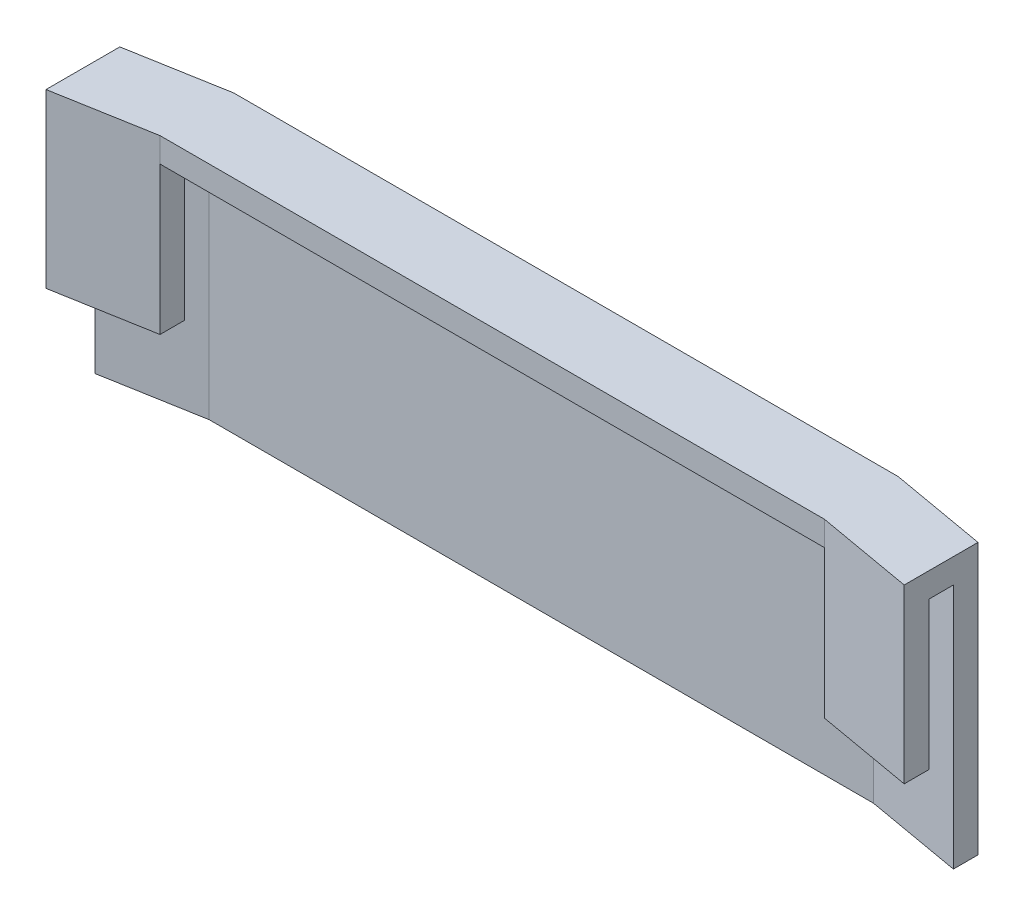
from build123d import *

# Parameters (mm, degrees)
BOSS_EXTRUDE1_DEPTH = 2
BOSS_EXTRUDE5_DEPTH = 22
BOSS_EXTRUDE6_DEPTH = 12


with BuildPart() as part:
    # Sketch1 → Boss-Extrude1 (new body)
    with BuildSketch(Plane(origin=(0, 0, 0), x_dir=(1, 0, 0), z_dir=(0, 1, 0))):
        Polygon((-27, 0), (27, 0), (34.878462024, -1.389185421), (34.878462024, 4.610814579), (27, 6), (-27, 6), (-34.878462024, 4.610814579), (-34.878462024, -1.389185421), align=None)
    extrude(amount=BOSS_EXTRUDE1_DEPTH)

    # Sketch3 → Boss-Extrude5 (add)
    with BuildSketch(Plane(origin=(0, 2, 0), x_dir=(1, 0, 0), z_dir=(0, 1, 0))):
        Polygon((-27, 4), (27, 4), (34.878462024, 2.610814579), (34.878462024, 4.610814579), (27, 6), (-27, 6), (-34.878462024, 4.610814579), (-34.878462024, 2.610814579), align=None)
    extrude(amount=-BOSS_EXTRUDE5_DEPTH)

    # Sketch8 → Boss-Extrude6 (add)
    with BuildSketch(Plane.XZ):
        Polygon((-34.878462024, 1.389185421), (-34.878462024, -0.610814579), (-27, -2), (-27, 0), align=None)
        Polygon((27, 0), (34.878462024, 1.389185421), (34.878462024, -0.610814579), (27, -2), align=None)
    extrude(amount=BOSS_EXTRUDE6_DEPTH)


solid = part.part
